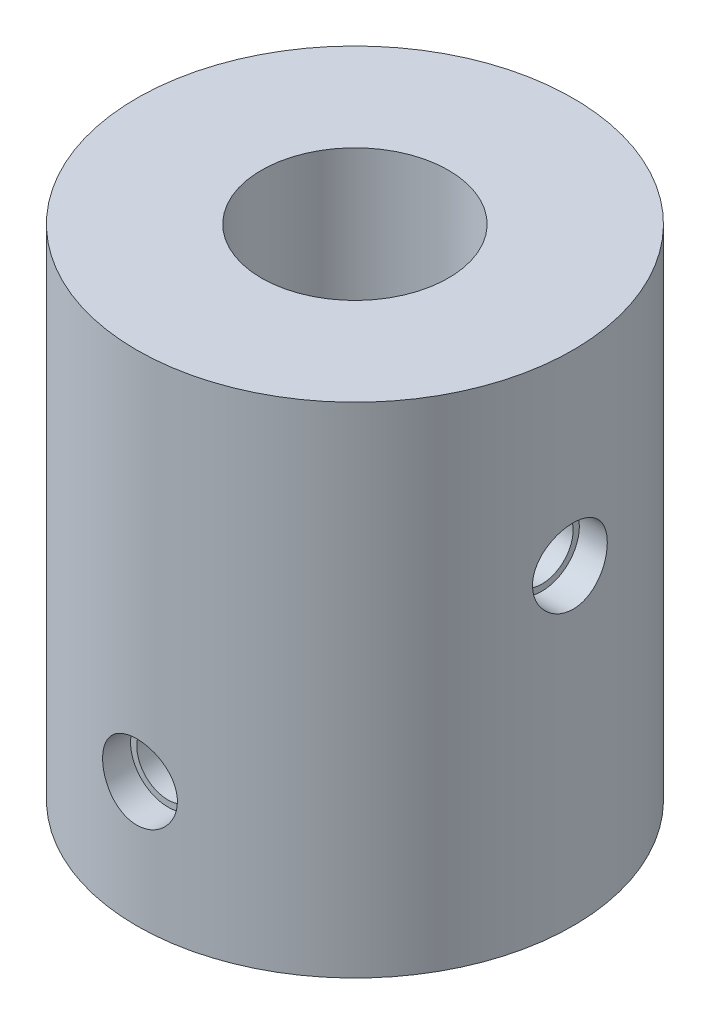
from build123d import *

# Parameters (mm, degrees)
SKETCH1_R                      = 3.5
SKETCH1_R_2                    = 1.5
BOSS_EXTRUDE1_DEPTH            = 8
CUT_EXTRUDE1_REACH             = 11.407
SKETCH2_R                      = 0.5
CUT_EXTRUDE1_DIRECTION_2_REACH = 11.407
SKETCH3_R                      = 0.5
CUT_EXTRUDE2_DEPTH             = 3.5
CUT_EXTRUDE3_START             = 4
SKETCH4_R                      = 0.6
CUT_EXTRUDE3_DEPTH             = 1
CUT_EXTRUDE4_START             = 4
SKETCH7_R                      = 0.6
CUT_EXTRUDE4_DEPTH             = 1


with BuildPart() as part:
    # Sketch1 → Boss-Extrude1 (new body)
    with BuildSketch(Plane(origin=(0, 0, 0), x_dir=(1, 0, 0), z_dir=(0, 1, 0))):
        with Locations(Location((0, 0, 0), (0, 0, 270))):
            Circle(SKETCH1_R)
        with Locations(Location((0, 0, 0), (0, 0, 270))):
            Circle(SKETCH1_R_2, mode=Mode.SUBTRACT)
    extrude(amount=BOSS_EXTRUDE1_DEPTH)

    # Sketch2 → Cut-Extrude1 (cut, up to next)
    with BuildSketch(Plane(origin=(0, 0, 0), x_dir=(0, 0, -1), z_dir=(1, 0, 0)), mode=Mode.PRIVATE) as cut_extrude1_sk1:
        with Locations((0, 5)):
            Circle(SKETCH2_R)
    cut_extrude1_tool1 = extrude(cut_extrude1_sk1.sketch, amount=-CUT_EXTRUDE1_REACH, mode=Mode.PRIVATE) & part.part
    add(cut_extrude1_tool1.solids().sort_by_distance((0, 5, 0))[0], mode=Mode.SUBTRACT)

    # Sketch2 → Cut-Extrude1 direction 2 (cut, up to next)
    with BuildSketch(Plane(origin=(0, 0, 0), x_dir=(0, 0, -1), z_dir=(1, 0, 0)), mode=Mode.PRIVATE) as cut_extrude1_direction_2_sk1:
        with Locations((0, 5)):
            Circle(SKETCH2_R)
    cut_extrude1_direction_2_tool1 = extrude(cut_extrude1_direction_2_sk1.sketch, amount=CUT_EXTRUDE1_DIRECTION_2_REACH, mode=Mode.PRIVATE) & part.part
    add(cut_extrude1_direction_2_tool1.solids().sort_by_distance((0, 5, 0))[0], mode=Mode.SUBTRACT)

    # Sketch3 → Cut-Extrude2 (cut, symmetric)
    with BuildSketch(Plane.XY):
        with Locations((0, 2)):
            Circle(SKETCH3_R)
    extrude(amount=CUT_EXTRUDE2_DEPTH, both=True, mode=Mode.SUBTRACT)

    # Sketch4 → Cut-Extrude3 (cut)
    with BuildSketch(Plane.XY.offset(CUT_EXTRUDE3_START)):
        with Locations((0, 2)):
            Circle(SKETCH4_R)
    extrude(amount=-CUT_EXTRUDE3_DEPTH, mode=Mode.SUBTRACT)

    # Sketch7 → Cut-Extrude4 (cut)
    with BuildSketch(Plane(origin=(0, 0, 0), x_dir=(0, 0, -1), z_dir=(1, 0, 0)).offset(CUT_EXTRUDE4_START)):
        with Locations((0, 5)):
            Circle(SKETCH7_R)
    extrude(amount=-CUT_EXTRUDE4_DEPTH, mode=Mode.SUBTRACT)


solid = part.part
